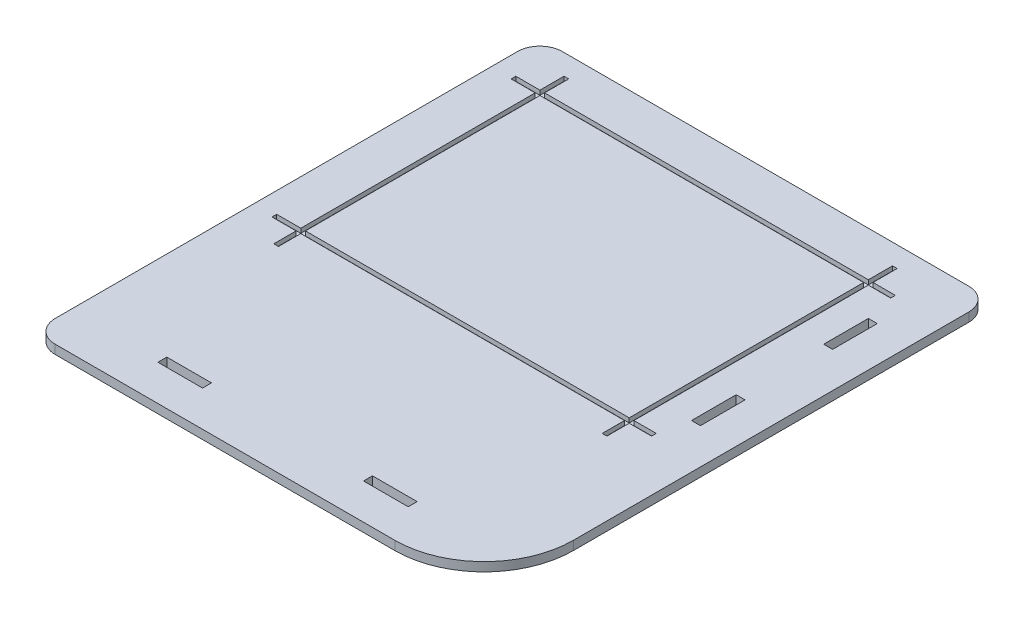
from build123d import *

# Parameters (mm, degrees)
SKETCH1_W           = 20
SKETCH1_H           = 4
SKETCH1_W_2         = 4
SKETCH1_H_2         = 20
BOSS_EXTRUDE1_DEPTH = 4
SKETCH2_W           = 145
SKETCH2_H           = 105
CUT_EXTRUDE1_DEPTH  = 2


with BuildPart() as part:
    # Sketch1 → Boss-Extrude1 (new body)
    with BuildSketch(Plane(origin=(0, 0, 0), x_dir=(1, 0, 0), z_dir=(0, 1, 0))):
        with BuildLine():
            Line((-12.1, 127.1), (170, 127.1))
            ThreePointArc((170, 127.1), (177.071067812, 124.171067812), (180, 117.1))
            Line((180, 117.1), (180, -60))
            ThreePointArc((180, -60), (168.284271247, -88.284271247), (140, -100))
            Line((140, -100), (-12.1, -100))
            ThreePointArc((-12.1, -100), (-19.171067812, -97.071067812), (-22.1, -90))
            Line((-22.1, -90), (-22.1, 117.1))
            ThreePointArc((-22.1, 117.1), (-19.171067812, 124.171067812), (-12.1, 127.1))
        make_face()
        with Locations((27.9, -82)):
            Rectangle(SKETCH1_W, SKETCH1_H, mode=Mode.SUBTRACT)
        with Locations((120, -82)):
            Rectangle(SKETCH1_W, SKETCH1_H, mode=Mode.SUBTRACT)
        with Locations((162, 82.1)):
            Rectangle(SKETCH1_W_2, SKETCH1_H_2, mode=Mode.SUBTRACT)
        with Locations((162, 22.9)):
            Rectangle(SKETCH1_W_2, SKETCH1_H_2, mode=Mode.SUBTRACT)
    extrude(amount=BOSS_EXTRUDE1_DEPTH)

    # Sketch2 → Cut-Extrude1 (cut)
    with BuildSketch(Plane(origin=(0, 4, 0), x_dir=(1, 0, 0), z_dir=(0, 1, 0))):
        Polygon((-12.9, 0), (-2.1, 0), (-2.1, 105), (-12.9, 105), (-12.9, 107.1), (-2.1, 107.1), (-2.1, 117.9), (0, 117.9), (0, 107.1), (145, 107.1), (145, 117.9), (147.1, 117.9), (147.1, 107.1), (157.1, 107.1), (157.1, 105), (147.1, 105), (147.1, 0), (157.1, 0), (157.1, -2.1), (147.1, -2.1), (147.1, -12.1), (145, -12.1), (145, -2.1), (0, -2.1), (0, -12.1), (-2.1, -12.1), (-2.1, -2.1), (-12.9, -2.1), align=None)
        with Locations((72.5, 52.5)):
            Rectangle(SKETCH2_W, SKETCH2_H, mode=Mode.SUBTRACT)
    extrude(amount=-CUT_EXTRUDE1_DEPTH, mode=Mode.SUBTRACT)


solid = part.part
